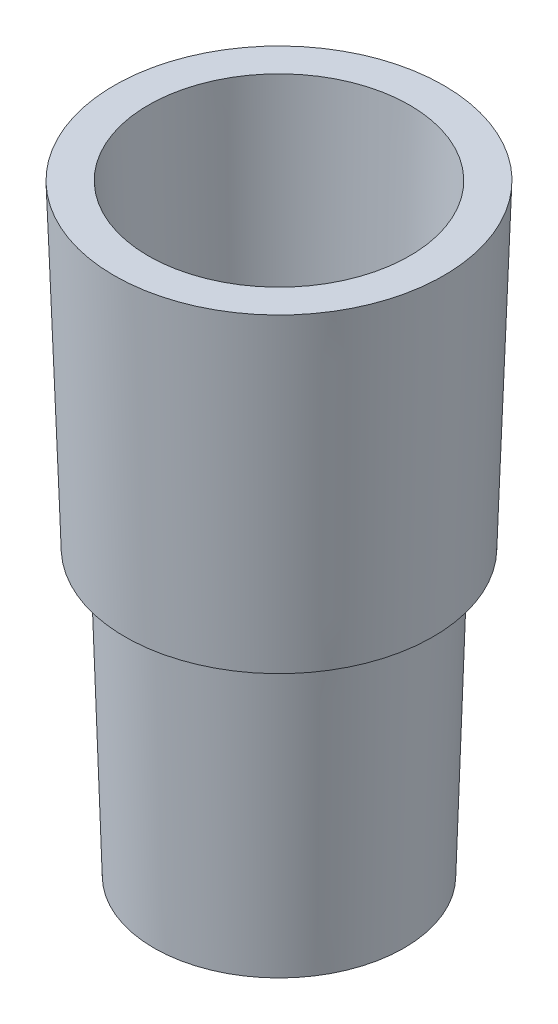
from build123d import *


with BuildPart() as part:
    # Sketch1 → Revolve1 (revolve)
    with BuildSketch(Plane.XY, mode=Mode.PRIVATE) as revolve1_sk:
        Polygon((8, 0), (8, 28), (10.75, 30.75), (11.5, 53), (14.5, 53), (13.556179775, 25), (11.75, 25), (11, 0), align=None)
    revolve(revolve1_sk.sketch.rotate(Axis((0, 0, 0), (0, 1, 0)), 90), axis=Axis((0, 0, 0), (0, 1, 0)))


solid = part.part
